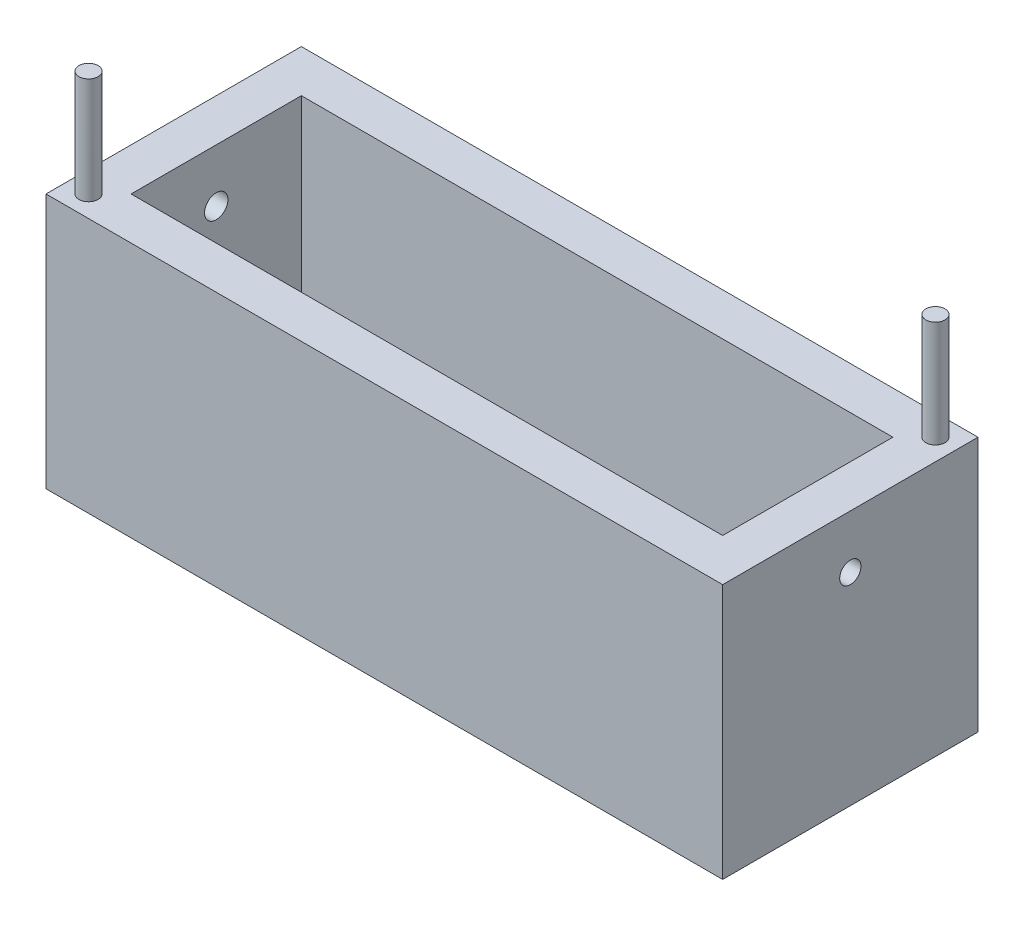
from build123d import *

# Parameters (mm, degrees)
SKETCH1_W           = 403.86
SKETCH1_H           = 152.4
BOSS_EXTRUDE1_DEPTH = 152.4
SKETCH2_W           = 353.06
SKETCH2_H           = 101.6
CUT_EXTRUDE1_DEPTH  = 139.7
SKETCH5_R           = 5.715
BOSS_EXTRUDE2_DEPTH = 63.5
SKETCH6_R           = 5.715
BOSS_EXTRUDE3_DEPTH = 63.5
SKETCH7_R           = 6.35
CUT_EXTRUDE4_DEPTH  = 63.5
SKETCH8_R           = 6.985
CUT_EXTRUDE5_DEPTH  = 63.5


with BuildPart() as part:
    # Sketch1 → Boss-Extrude1 (new body)
    with BuildSketch(Plane(origin=(0, 0, 0), x_dir=(1, 0, 0), z_dir=(0, 1, 0))):
        with Locations((201.93, 76.2)):
            Rectangle(SKETCH1_W, SKETCH1_H)
    extrude(amount=-BOSS_EXTRUDE1_DEPTH)

    # Sketch2 → Cut-Extrude1 (cut)
    with BuildSketch(Plane(origin=(0, 0, 0), x_dir=(1, 0, 0), z_dir=(0, 1, 0))):
        with Locations((201.93, 76.2)):
            Rectangle(SKETCH2_W, SKETCH2_H)
    extrude(amount=-CUT_EXTRUDE1_DEPTH, mode=Mode.SUBTRACT)

    # Sketch5 → Boss-Extrude2 (add)
    with BuildSketch(Plane(origin=(0, 0, 0), x_dir=(1, 0, 0), z_dir=(0, 1, 0))):
        with Locations(Location((12.7, 12.7, 0), (0, 0, 90))):
            Circle(SKETCH5_R)
    extrude(amount=BOSS_EXTRUDE2_DEPTH)

    # Sketch6 → Boss-Extrude3 (add)
    with BuildSketch(Plane(origin=(0, 0, 0), x_dir=(1, 0, 0), z_dir=(0, 1, 0))):
        with Locations(Location((391.16, 139.7, 0), (0, 0, 90))):
            Circle(SKETCH6_R)
    extrude(amount=BOSS_EXTRUDE3_DEPTH)

    # Sketch7 → Cut-Extrude4 (cut)
    with BuildSketch(Plane(origin=(403.86, 0, 0), x_dir=(0, 0, -1), z_dir=(1, 0, 0))):
        with Locations((76.2, -31.75)):
            Circle(SKETCH7_R)
    extrude(amount=-CUT_EXTRUDE4_DEPTH, mode=Mode.SUBTRACT)

    # Sketch8 → Cut-Extrude5 (cut)
    with BuildSketch(Plane.ZY):
        with Locations((-76.2, -31.75)):
            Circle(SKETCH8_R)
    extrude(amount=-CUT_EXTRUDE5_DEPTH, mode=Mode.SUBTRACT)


solid = part.part
